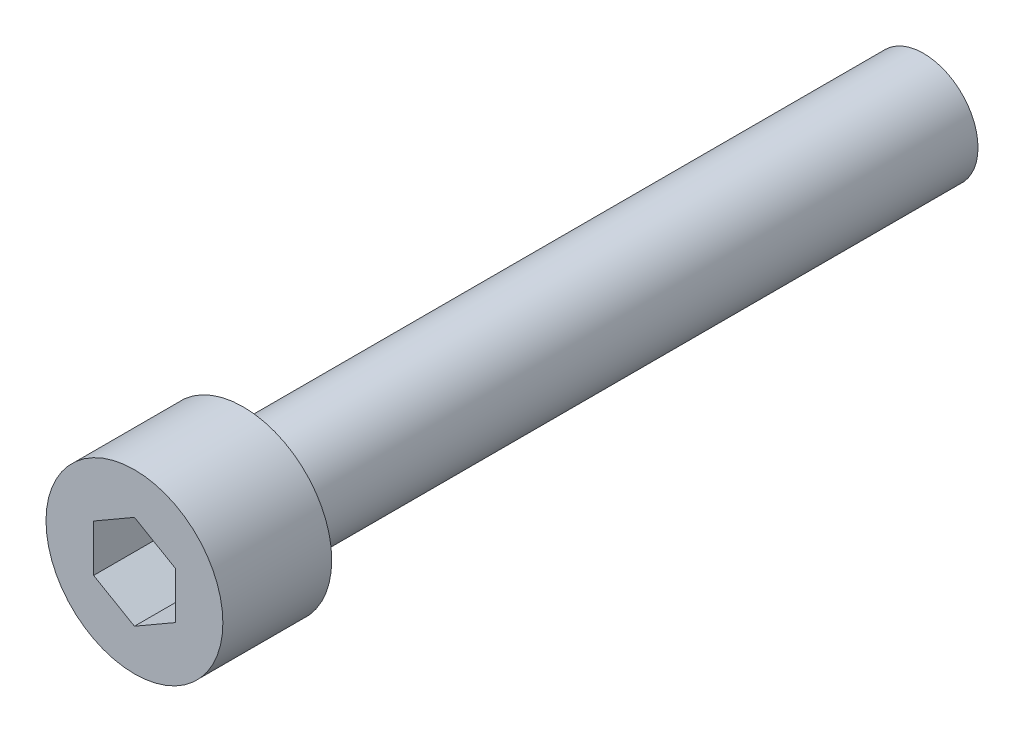
from build123d import *

# Parameters (mm, degrees)
WYTNIJ_WYCI_GNI_CIE1_DEPTH = 6


with BuildPart() as part:
    # Szkic1 → Obrót1 (revolve)
    with BuildSketch(Plane(origin=(0, 0, 0), x_dir=(0, 0, -1), z_dir=(1, 0, 0)), mode=Mode.PRIVATE) as obr_t1_sk:
        Polygon((0, 0), (0, 6.5), (8, 6.5), (8, 4), (58, 4), (58, 0), align=None)
    revolve(obr_t1_sk.sketch.rotate(Axis((0, 0, 0), (0, 0, -1)), 90), axis=Axis((0, 0, 0), (0, 0, -1)))

    # Szkic2 → Wytnij-wyciągnięcie1 (cut)
    with BuildSketch(Plane.XY):
        Polygon((-3, -1.732050808), (0, -3.464101615), (3, -1.732050808), (3, 1.732050808), (0, 3.464101615), (-3, 1.732050808), align=None)
    extrude(amount=-WYTNIJ_WYCI_GNI_CIE1_DEPTH, mode=Mode.SUBTRACT)


solid = part.part
